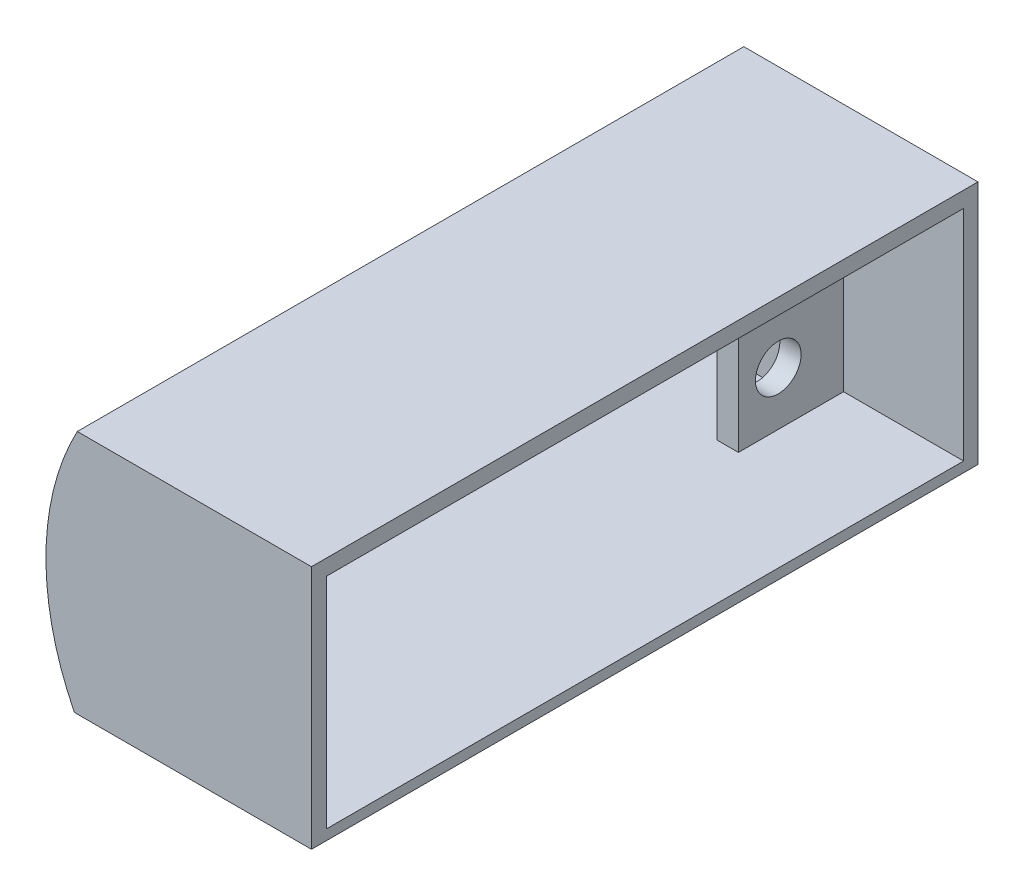
from build123d import *
from build123d.topology import SkipClean

# Parameters (mm, degrees)
SKETCH1_R                = 25
SKETCH1_W                = 27.5
SKETCH1_H                = 27.5
BOSS_EXTRUDE1_DEPTH      = 55
BOSS_EXTRUDE2_START      = 5
SKETCH2_R                = 25
BOSS_EXTRUDE2_DEPTH      = 5
SKETCH3_W                = 25
SKETCH3_H                = 50
BOSS_EXTRUDE3_DEPTH      = 80
FILLET1_R                = 2.5
FILLET2_R                = 2.5
SKETCH21_W               = 60
SKETCH21_H               = 20.6
CUT_EXTRUDE1_DEPTH       = 11.3
SKETCH22_W               = 40.5
SKETCH22_H               = 20.6
CUT_EXTRUDE2_DEPTH       = 93.059763198
CUT_EXTRUDE3_DEPTH       = 88.464278423
SKETCH23_R               = 2.15
CUT_EXTRUDE4_DEPTH       = 93.059763198
CUT_EXTRUDE7_DEPTH       = 27.5
CUT_EXTRUDE9_DEPTH       = 93.059763198
CUT_EXTRUDE10_DEPTH      = 91.545224131
CUT_EXTRUDE10_DEPTH_BACK = 91.545224131
SKETCH26_W               = 75.598787472
SKETCH26_H               = 50


with BuildPart() as part:
    # Sketch1 → Boss-Extrude1 (new body)
    with BuildSketch(Plane.XY):
        Circle(SKETCH1_R)
        Rectangle(SKETCH1_W, SKETCH1_H, mode=Mode.SUBTRACT)
    extrude(amount=BOSS_EXTRUDE1_DEPTH)

    # Sketch2 → Boss-Extrude2 (add)
    with BuildSketch(Plane(origin=(0, 0, 0), x_dir=(-1, 0, 0), z_dir=(0, 0, -1)).offset(BOSS_EXTRUDE2_START)):
        Circle(SKETCH2_R)
    extrude(amount=-BOSS_EXTRUDE2_DEPTH)

    # Sketch3 → Boss-Extrude3 (add)
    with BuildSketch(Plane(origin=(0, 0, -5), x_dir=(-1, 0, 0), z_dir=(0, 0, -1))):
        with Locations((12.5, 0)):
            Rectangle(SKETCH3_W, SKETCH3_H)
    extrude(amount=BOSS_EXTRUDE3_DEPTH)

    # Fillet1
    fillet1_edges = [part.edges().sort_by_distance(p)[0] for p in [
        (-13.75, 13.75, 27.5),
        (13.75, 13.75, 27.5),
        (-13.75, -13.75, 27.5),
        (13.75, -13.75, 27.5),
    ]]
    fillet(fillet1_edges, radius=FILLET1_R)

    # Fillet2
    fillet2_edges = [part.edges().sort_by_distance(p)[0] for p in [
        (13.75, 0, 55),
    ]]
    fillet(fillet2_edges, radius=FILLET2_R)

    # Sketch21 → Cut-Extrude1 (cut)
    with BuildSketch(Plane(origin=(0, 0, 0), x_dir=(0, 0, -1), z_dir=(1, 0, 0))):
        with Locations((52, 0)):
            Rectangle(SKETCH21_W, SKETCH21_H)
    extrude(amount=-CUT_EXTRUDE1_DEPTH, mode=Mode.SUBTRACT)

    # Sketch22 → Cut-Extrude2 (cut, through all)
    with BuildSketch(Plane(origin=(0, 0, 0), x_dir=(0, 0, -1), z_dir=(1, 0, 0))):
        with Locations((51.85, 0)):
            Rectangle(SKETCH22_W, SKETCH22_H)
    extrude(amount=-CUT_EXTRUDE2_DEPTH, mode=Mode.SUBTRACT)

    # Sketch18 → Cut-Extrude3 (cut, through all)
    with BuildSketch(Plane.XY.offset(-5)):
        with BuildLine():
            Line((-25, -25), (0, -25))
            ThreePointArc((0, -25), (-17.67766953, -17.67766953), (-25, 0))
            Line((-25, 0), (-25, -25))
        make_face()
        with BuildLine():
            Line((-25, 25), (-25, 0))
            ThreePointArc((-25, 0), (-17.67766953, 17.67766953), (0, 25))
            Line((0, 25), (-25, 25))
        make_face()
    extrude(amount=-CUT_EXTRUDE3_DEPTH, mode=Mode.SUBTRACT)

    # Sketch23 → Cut-Extrude4 (cut, through all)
    with BuildSketch(Plane(origin=(0, 0, 0), x_dir=(0, 0, -1), z_dir=(1, 0, 0))):
        with Locations((75.85, 5.25)):
            Circle(SKETCH23_R)
        with Locations((75.85, -5.25)):
            Circle(SKETCH23_R)
        with Locations((27.85, 5.25)):
            Circle(SKETCH23_R)
        with Locations((27.85, -5.25)):
            Circle(SKETCH23_R)
    extrude(amount=-CUT_EXTRUDE4_DEPTH, mode=Mode.SUBTRACT)

    # Sketch24 → Cut-Extrude7 (cut, symmetric)
    with BuildSketch(Plane(origin=(0, 0, -51.85), x_dir=(-1, 0, 0), z_dir=(0, 0, -1))):
        with BuildLine():
            Line((22.779596133, 10.3), (13.3, 10.3))
            Line((13.3, 10.3), (13.3, -10.3))
            Line((13.3, -10.3), (22.779596133, -10.3))
            ThreePointArc((22.779596133, -10.3), (25, 0), (22.779596133, 10.3))
        make_face()
    extrude(amount=CUT_EXTRUDE7_DEPTH, both=True, mode=Mode.SUBTRACT)

    # Sketch25 → Cut-Extrude9 (cut, through all)
    with BuildSketch(Plane(origin=(0, 0, 0), x_dir=(0, 0, -1), z_dir=(1, 0, 0))):
        Polygon((85, 25), (20.598787472, 25), (20.598787472, 11.783494563), (83.357288901, 11.783494563), (83.357288901, -11.262677124), (20.598787472, -11.262677124), (20.598787472, -25), (85, -25), (85, -11.262677124), (85, 11.783494563), align=None)
    extrude(amount=-CUT_EXTRUDE9_DEPTH, mode=Mode.SUBTRACT)

    # Sketch26 → Cut-Extrude10 (cut, two sides: drawn at the far end of the back side and taken through both)
    with SkipClean():  # the faces are left unmerged after this step: merging them gives an invalid solid
        with BuildSketch(Plane(origin=(0, 0, 0), x_dir=(0, 0, -1), z_dir=(1, 0, 0)).offset(-CUT_EXTRUDE10_DEPTH_BACK)):
            with Locations((-17.200606264, 0)):
                Rectangle(SKETCH26_W, SKETCH26_H)
        extrude(amount=CUT_EXTRUDE10_DEPTH + CUT_EXTRUDE10_DEPTH_BACK, mode=Mode.SUBTRACT)


solid = part.part
